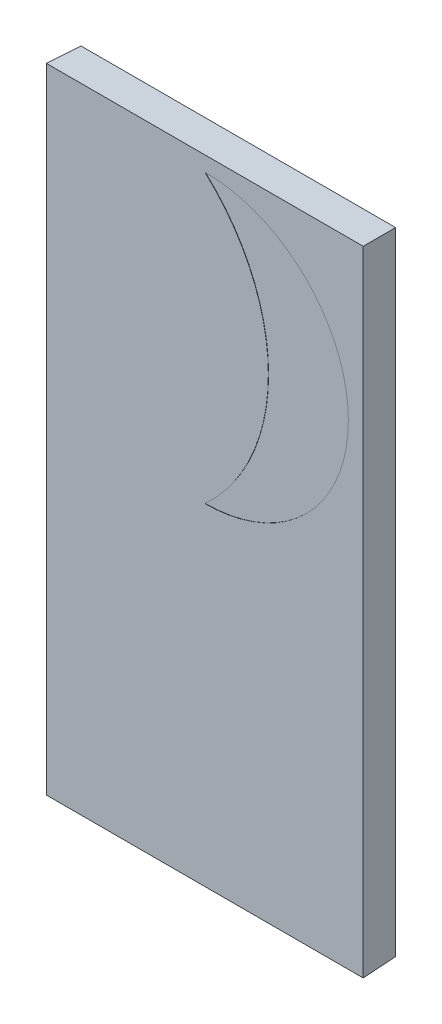
from build123d import *

# Parameters (mm, degrees)
SKETCH1_W           = 128
SKETCH1_H           = 256
BOSS_EXTRUDE1_DEPTH = 13.56
BOSS_EXTRUDE1_DRAFT = -2
CUT_EXTRUDE1_DEPTH  = 10.84
SKETCH3_R           = 1.32
CUT_EXTRUDE2_DEPTH  = 10
FILLET1_R           = 10
FILLET2_R           = 2
CUT_EXTRUDE3_DEPTH  = 0.1


with BuildPart() as part:
    # Sketch1 → Boss-Extrude1 (with draft: the straight prism first)
    with BuildSketch(Plane.XY):
        Rectangle(SKETCH1_W, SKETCH1_H)
    extrude(amount=-BOSS_EXTRUDE1_DEPTH)
    # Boss-Extrude1: the draft: its side faces are tilted about the plane it starts from
    boss_extrude1_sides = [part.faces().sort_by_distance(p)[0] for p in [
        (0, -128, -6.78),
        (64, 0, -6.78),
        (0, 128, -6.78),
        (-64, 0, -6.78),
    ]]
    draft(boss_extrude1_sides, Plane.XY, BOSS_EXTRUDE1_DRAFT)

    # Sketch2 → Cut-Extrude1 (cut)
    with BuildSketch(Plane(origin=(0, 0, -13.56), x_dir=(-1, 0, 0), z_dir=(0, 0, -1))):
        Polygon((-52.526474366, -6.13), (52.526474366, -6.13), (52.526474366, -116.526474366), (17, -116.526474366), (17, -120.656474366), (-17, -120.656474366), (-17, -116.526474366), (-52.526474366, -116.526474366), align=None)
        Polygon((-52.526474366, 6.13), (-52.526474366, 116.526474366), (-17, 116.526474366), (-17, 120.656474366), (17, 120.656474366), (17, 116.526474366), (52.526474366, 116.526474366), (52.526474366, 6.13), align=None)
    extrude(amount=-CUT_EXTRUDE1_DEPTH, mode=Mode.SUBTRACT)

    # Sketch3 → Cut-Extrude2 (cut)
    with BuildSketch(Plane(origin=(0, 0, -13.56), x_dir=(-1, 0, 0), z_dir=(0, 0, -1))):
        with Locations((56, -120.026474366)):
            Circle(SKETCH3_R)
        with Locations((56, 0)):
            Circle(SKETCH3_R)
        with Locations(Location((56, 120.026474366, 0), (0, 0, 180))):
            Circle(SKETCH3_R)
        with Locations(Location((-56, -120.026474366, 0), (0, 0, 180))):
            Circle(SKETCH3_R)
        with Locations(Location((-56, 0, 0), (0, 0, 180))):
            Circle(SKETCH3_R)
        with Locations((-56, 120.026474366)):
            Circle(SKETCH3_R)
    extrude(amount=-CUT_EXTRUDE2_DEPTH, mode=Mode.SUBTRACT)

    # Fillet1
    fillet1_edges = [part.edges().sort_by_distance(p)[0] for p in [
        (52.526474366, 116.526474366, -8.14),
        (-52.526474366, 116.526474366, -8.14),
        (-52.526474366, -116.526474366, -8.14),
        (52.526474366, -116.526474366, -8.14),
    ]]
    fillet(fillet1_edges, radius=FILLET1_R)

    # Fillet2
    fillet2_edges = [part.edges().sort_by_distance(p)[0] for p in [
        (17, 116.526474366, -8.14),
        (17, 120.656474366, -8.14),
        (-17, 120.656474366, -8.14),
        (-17, 116.526474366, -8.14),
        (-17, -116.526474366, -8.14),
        (-17, -120.656474366, -8.14),
        (17, -120.656474366, -8.14),
        (17, -116.526474366, -8.14),
    ]]
    fillet(fillet2_edges, radius=FILLET2_R)

    # Sketch5 → Cut-Extrude3 (cut)
    with BuildSketch(Plane.XY):
        with BuildLine():
            ThreePointArc((0, 6.005906984), (41.00801644, 22.99198356), (57.994093016, 64))
            ThreePointArc((57.994093016, 64), (41.00801644, 105.00801644), (0, 121.994093016))
            ThreePointArc((0, 121.994093016), (18.969220237, 95.711668256), (25.674983731, 64))
            ThreePointArc((25.674983731, 64), (18.969220237, 32.288331744), (0, 6.005906984))
        make_face()
    extrude(amount=-CUT_EXTRUDE3_DEPTH, mode=Mode.SUBTRACT)


solid = part.part
